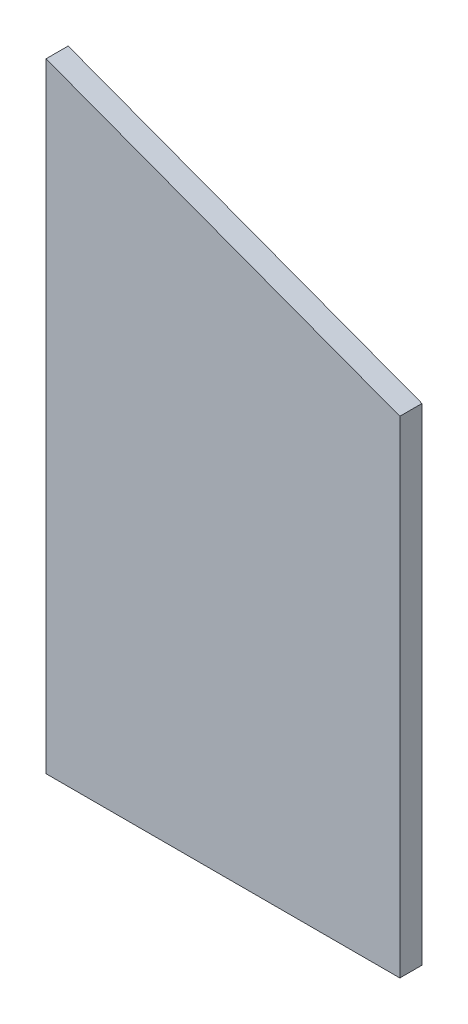
from build123d import *

# Parameters (mm, degrees)
BOSS_EXTRUDE1_DEPTH = 6.35


with BuildPart() as part:
    # Sketch1 → Boss-Extrude1 (new body)
    with BuildSketch(Plane.XY):
        Polygon((0, 0), (0, 177.8), (101.6, 139.7), (101.6, 0), align=None)
    extrude(amount=BOSS_EXTRUDE1_DEPTH)


solid = part.part
